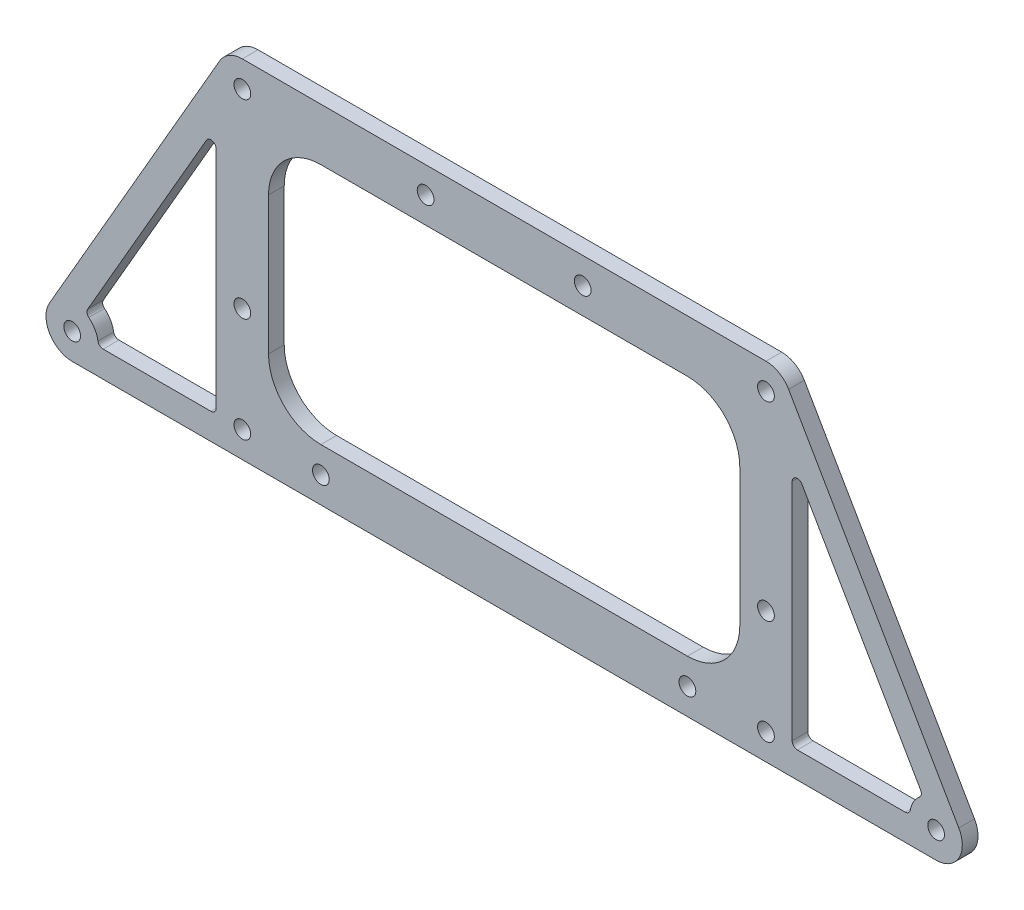
from build123d import *

# Parameters (mm, degrees)
SKETCH_1_R      = 1.6
SKETCH_1_W      = 90
SKETCH_1_H      = 46.291651246
EXTRUDE_1_DEPTH = 3
FILLET_1_R      = 1
FILLET_2_R      = 10


with BuildPart() as part:
    # ｽｹｯﾁ1 → ﾎﾞｽ - 押し出し1 (new body)
    with BuildSketch(Plane.XY):
        with BuildLine():
            Line((50, 33.145825623), (-50, 33.145825623))
            ThreePointArc((-50, 33.145825623), (-52.5, 32.475952642), (-54.330127019, 30.645825623))
            Line((-54.330127019, 30.645825623), (-86.830127019, -25.645825623))
            ThreePointArc((-86.830127019, -25.645825623), (-86.830127019, -30.645825623), (-82.5, -33.145825623))
            Line((-82.5, -33.145825623), (-50, -33.145825623))
            Line((-50, -33.145825623), (50, -33.145825623))
            Line((50, -33.145825623), (82.5, -33.145825623))
            ThreePointArc((82.5, -33.145825623), (86.830127019, -30.645825623), (86.830127019, -25.645825623))
            Line((86.830127019, -25.645825623), (54.330127019, 30.645825623))
            ThreePointArc((54.330127019, 30.645825623), (52.5, 32.475952642), (50, 33.145825623))
        make_face()
        with Locations((-50, 28.145825623)):
            Circle(SKETCH_1_R, mode=Mode.SUBTRACT)
        with Locations((-82.5, -28.145825623)):
            Circle(SKETCH_1_R, mode=Mode.SUBTRACT)
        with Locations((50, 28.145825623)):
            Circle(SKETCH_1_R, mode=Mode.SUBTRACT)
        with Locations((82.5, -28.145825623)):
            Circle(SKETCH_1_R, mode=Mode.SUBTRACT)
        with Locations((-50, -28.145825623)):
            Circle(SKETCH_1_R, mode=Mode.SUBTRACT)
        with Locations((50, -28.145825623)):
            Circle(SKETCH_1_R, mode=Mode.SUBTRACT)
        with Locations((-35, -28.145825623)):
            Circle(SKETCH_1_R, mode=Mode.SUBTRACT)
        with Locations(Location((35, -28.145825623, 0), (0, 0, 180))):
            Circle(SKETCH_1_R, mode=Mode.SUBTRACT)
        with Locations((-15, 28.145825623)):
            Circle(SKETCH_1_R, mode=Mode.SUBTRACT)
        with Locations(Location((15, 28.145825623, 0), (0, 0, 180))):
            Circle(SKETCH_1_R, mode=Mode.SUBTRACT)
        with Locations((-50, -8.145825623)):
            Circle(SKETCH_1_R, mode=Mode.SUBTRACT)
        with Locations(Location((50, -8.145825623, 0), (0, 0, 180))):
            Circle(SKETCH_1_R, mode=Mode.SUBTRACT)
        Rectangle(SKETCH_1_W, SKETCH_1_H, mode=Mode.SUBTRACT)
        with BuildLine():
            Line((-55, 19.485571585), (-55, -28.145825623))
            Line((-55, -28.145825623), (-77.5, -28.145825623))
            ThreePointArc((-77.5, -28.145825623), (-78.169872981, -25.645825623), (-80, -23.815698604))
            Line((-80, -23.815698604), (-55, 19.485571585))
        make_face(mode=Mode.SUBTRACT)
        with BuildLine():
            Line((55, -28.145825623), (77.5, -28.145825623))
            ThreePointArc((77.5, -28.145825623), (78.169872981, -25.645825623), (80, -23.815698604))
            Line((80, -23.815698604), (55, 19.485571585))
            Line((55, 19.485571585), (55, -28.145825623))
        make_face(mode=Mode.SUBTRACT)
    extrude(amount=EXTRUDE_1_DEPTH)

    # ﾌｨﾚｯﾄ1
    fillet_1_edges = [part.edges().sort_by_distance(p)[0] for p in [
        (-55, 19.485571585, 1.5),
        (-80, -23.815698604, 1.5),
        (-77.5, -28.145825623, 1.5),
        (-55, -28.145825623, 1.5),
        (77.5, -28.145825623, 1.5),
        (80, -23.815698604, 1.5),
        (55, 19.485571585, 1.5),
        (55, -28.145825623, 1.5),
    ]]
    fillet(fillet_1_edges, radius=FILLET_1_R)

    # ﾌｨﾚｯﾄ2
    fillet_2_edges = [part.edges().sort_by_distance(p)[0] for p in [
        (45, -23.145825623, 1.5),
        (45, 23.145825623, 1.5),
        (-45, 23.145825623, 1.5),
        (-45, -23.145825623, 1.5),
    ]]
    fillet(fillet_2_edges, radius=FILLET_2_R)


solid = part.part
